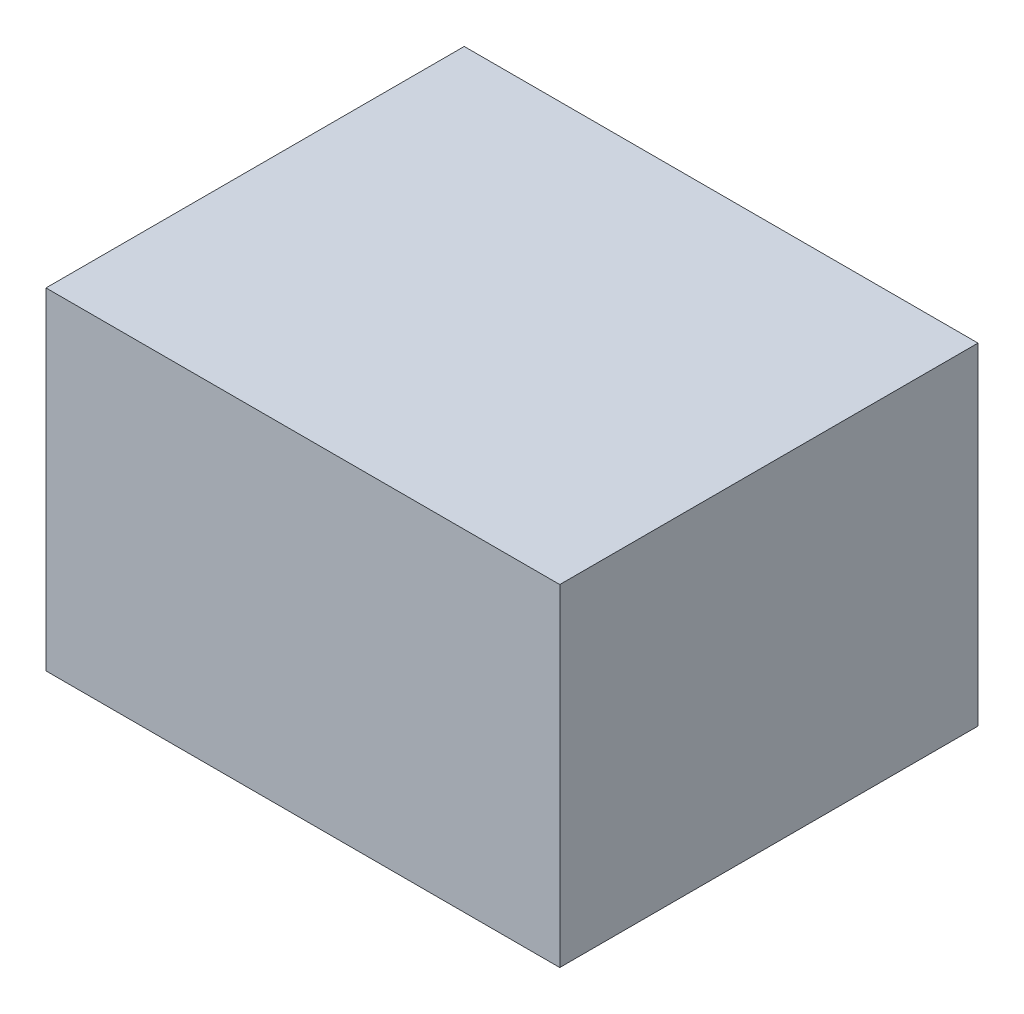
from build123d import *

# Parameters (mm, degrees)
SKETCH1_W           = 71.25
SKETCH1_H           = 58
BOSS_EXTRUDE1_DEPTH = 46


with BuildPart() as part:
    # Sketch1 → Boss-Extrude1 (new body)
    with BuildSketch(Plane(origin=(0, 0, 0), x_dir=(1, 0, 0), z_dir=(0, 1, 0))):
        Rectangle(SKETCH1_W, SKETCH1_H)
    extrude(amount=BOSS_EXTRUDE1_DEPTH)


solid = part.part
